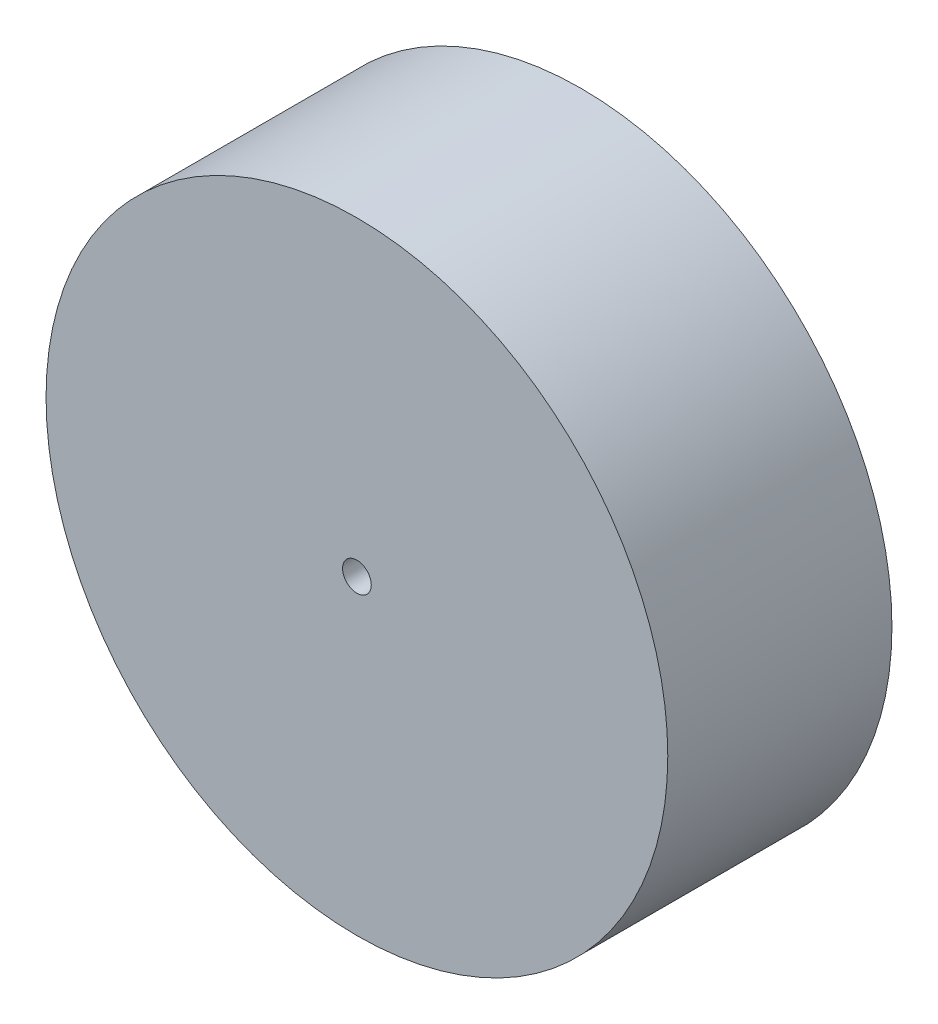
from build123d import *

# Parameters (mm, degrees)
SKETCH1_R           = 34.671
SKETCH1_R_2         = 1.6
BOSS_EXTRUDE1_DEPTH = 25


with BuildPart() as part:
    # Sketch1 → Boss-Extrude1 (new body)
    with BuildSketch(Plane.XY):
        Circle(SKETCH1_R)
        Circle(SKETCH1_R_2, mode=Mode.SUBTRACT)
    extrude(amount=BOSS_EXTRUDE1_DEPTH)


solid = part.part
